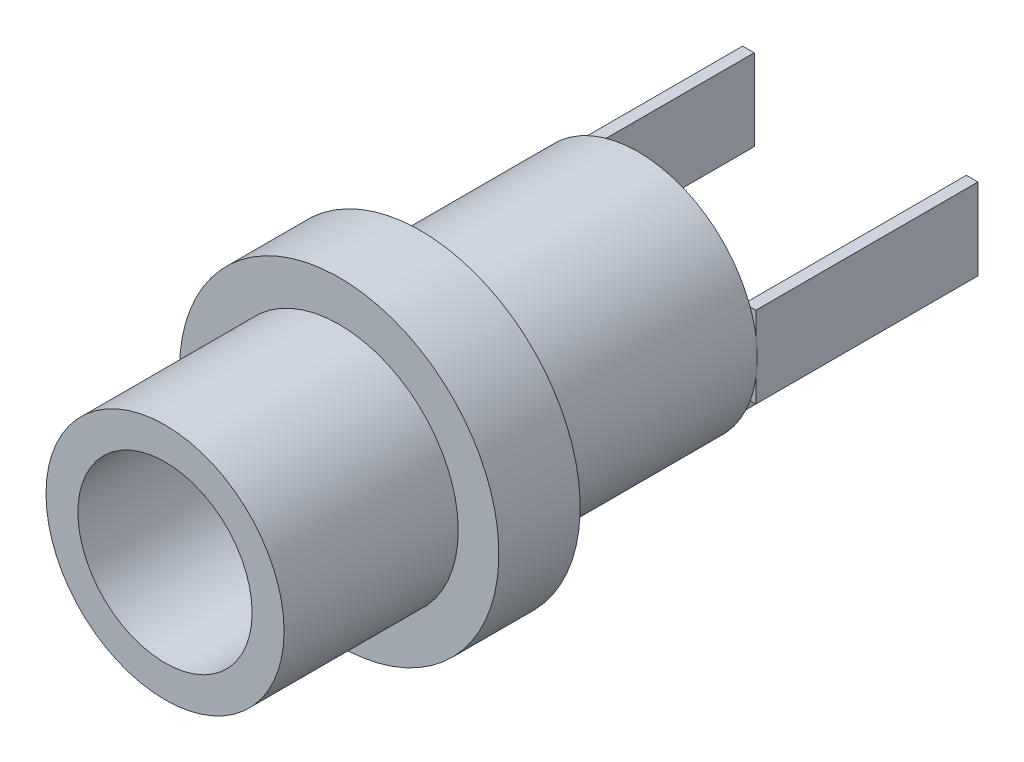
from build123d import *

# Parameters (mm, degrees)
SKETCH1_R           = 4.1
SKETCH1_R_2         = 3
BOSS_EXTRUDE1_DEPTH = 6
SKETCH2_R           = 5.5
BOSS_EXTRUDE2_DEPTH = 2.8
SKETCH3_R           = 4.1
BOSS_EXTRUDE3_DEPTH = 7.5
SKETCH4_W           = 0.4
SKETCH4_H           = 2.8
SKETCH4_W_2         = 2.8
SKETCH4_H_2         = 0.4
EXTRUDE_THIN1_DEPTH = 7.65


with BuildPart() as part:
    # Sketch1 → Boss-Extrude1 (new body)
    with BuildSketch(Plane.XY):
        Circle(SKETCH1_R)
        Circle(SKETCH1_R_2, mode=Mode.SUBTRACT)
    extrude(amount=-BOSS_EXTRUDE1_DEPTH)

    # Sketch2 → Boss-Extrude2 (add)
    with BuildSketch(Plane(origin=(0, 0, -6), x_dir=(-1, 0, 0), z_dir=(0, 0, -1))):
        Circle(SKETCH2_R)
    extrude(amount=BOSS_EXTRUDE2_DEPTH)

    # Sketch3 → Boss-Extrude3 (add)
    with BuildSketch(Plane(origin=(0, 0, -8.8), x_dir=(-1, 0, 0), z_dir=(0, 0, -1))):
        with Locations(Location((0, 0, 0), (0, 0, 180))):
            Circle(SKETCH3_R)
    extrude(amount=BOSS_EXTRUDE3_DEPTH)

    # Sketch4 → Extrude-Thin1 (add)
    with BuildSketch(Plane(origin=(0, 0, -16.3), x_dir=(-1, 0, 0), z_dir=(0, 0, -1))):
        with Locations((-3.853569774, 0)):
            Rectangle(SKETCH4_W, SKETCH4_H)
        with Locations((0, -3.853569774)):
            Rectangle(SKETCH4_W_2, SKETCH4_H_2)
        with Locations((3.853569774, 0)):
            Rectangle(SKETCH4_W, SKETCH4_H)
    extrude(amount=EXTRUDE_THIN1_DEPTH)


solid = part.part
